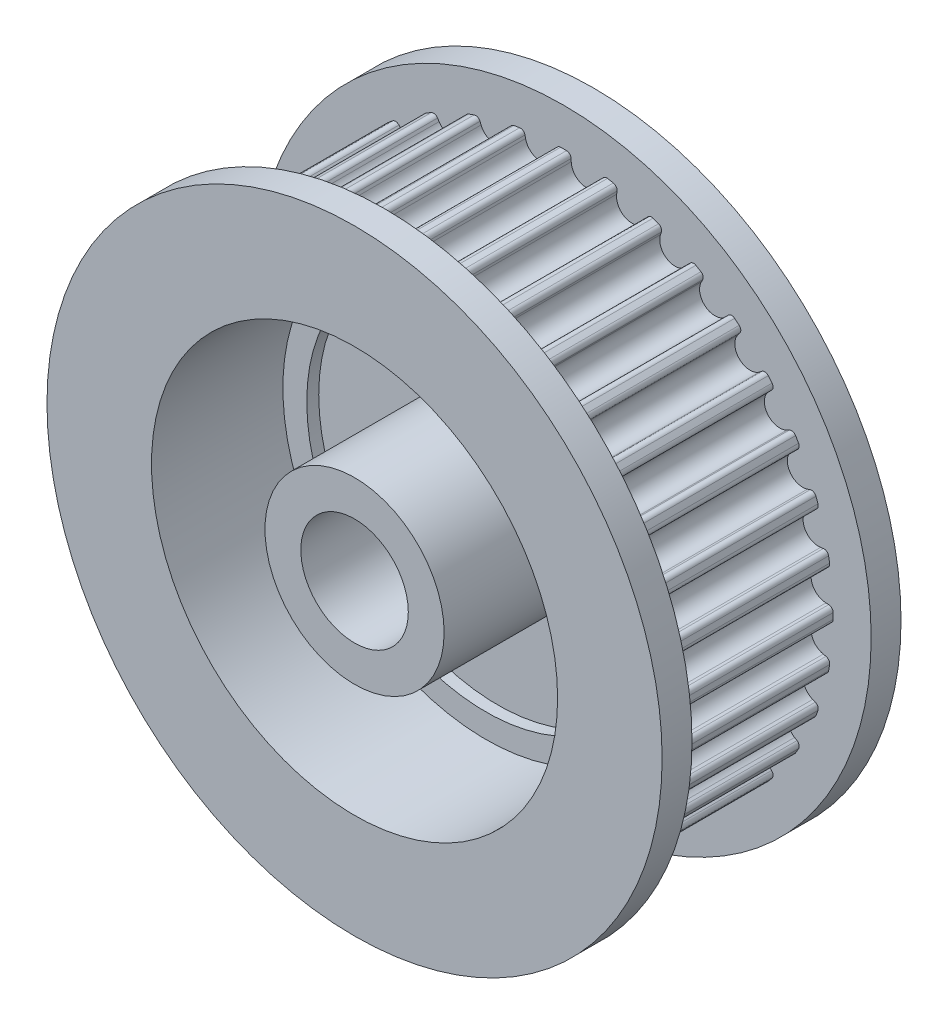
from build123d import *

# Parameters (mm, degrees)
SKETCH2_R         = 45.15
EXTRUDE1_DEPTH    = 15
EXTRUDE2_DEPTH    = 71.54817503
CIRPATTERN1_COUNT = 36
SKETCH3_R         = 51.5
EXTRUDE3_DEPTH    = 5
EXTRUDE4_START    = 5
SKETCH4_R         = 51.5
EXTRUDE4_DEPTH    = 5
SKETCH7_R         = 34
SKETCH7_R_2       = 15
EXTRUDE7_DEPTH    = 22
SKETCH8_R         = 9
EXTRUDE8_DEPTH    = 84.093321031
SKETCH9_R         = 30
SKETCH9_R_2       = 15
EXTRUDE9_DEPTH    = 2


with BuildPart() as part:
    # Sketch2 → Extrude1 (new, symmetric)
    with BuildSketch(Plane.XY):
        Circle(SKETCH2_R)
    extrude(amount=EXTRUDE1_DEPTH, both=True)

    # Sketch1 → Extrude2 (cut, through all)
    with BuildSketch(Plane.XY.offset(15)):
        with BuildLine():
            Line((-1.265610805, 44.394558923), (-1.282106289, 43.922190055))
            ThreePointArc((-1.282106289, 43.922190055), (-3.626550456, 41.451661388), (-6.364380048, 43.477548716))
            Line((-6.364380048, 43.477548716), (-6.462650922, 43.939876828))
            ThreePointArc((-6.462650922, 43.939876828), (-6.785899963, 44.421956093), (-7.352628199, 44.547293504))
            ThreePointArc((-7.352628199, 44.547293504), (-3.935081785, 44.978190619), (-0.494631081, 45.147290507))
            ThreePointArc((-0.494631081, 45.147290507), (-1.030984829, 44.925445927), (-1.265610805, 44.394558923))
        make_face()
    extrude2 = extrude(amount=-EXTRUDE2_DEPTH, mode=Mode.SUBTRACT)

    # CirPattern1: Extrude2 ×36 about axis
    cirpattern1_axis = Axis((0, 0, 0), (0, 0, 1))
    for i in range(1, CIRPATTERN1_COUNT):
        add(extrude2.rotate(cirpattern1_axis, i * 360 / CIRPATTERN1_COUNT), mode=Mode.SUBTRACT)

    # Sketch3 → Extrude3 (add)
    with BuildSketch(Plane(origin=(0, 0, -15), x_dir=(-1, 0, 0), z_dir=(0, 0, -1))):
        Circle(SKETCH3_R)
    extrude(amount=EXTRUDE3_DEPTH)

    # Sketch4 → Extrude4 (add)
    with BuildSketch(Plane.XY.offset(15).offset(EXTRUDE4_START)):
        with Locations(Location((0, 0, 0), (0, 0, 180))):
            Circle(SKETCH4_R)
    extrude(amount=-EXTRUDE4_DEPTH)

    # Sketch7 → Extrude7 (cut)
    with BuildSketch(Plane.XY.offset(20)):
        Circle(SKETCH7_R)
        Circle(SKETCH7_R_2, mode=Mode.SUBTRACT)
    extrude(amount=-EXTRUDE7_DEPTH, mode=Mode.SUBTRACT)

    # Sketch8 → Extrude8 (cut, through all)
    with BuildSketch(Plane.XY.offset(20)):
        Circle(SKETCH8_R)
    extrude(amount=-EXTRUDE8_DEPTH, mode=Mode.SUBTRACT)

    # Sketch9 → Extrude9 (cut)
    with BuildSketch(Plane.XY.offset(-2)):
        Circle(SKETCH9_R)
        Circle(SKETCH9_R_2, mode=Mode.SUBTRACT)
    extrude(amount=-EXTRUDE9_DEPTH, mode=Mode.SUBTRACT)


solid = part.part
